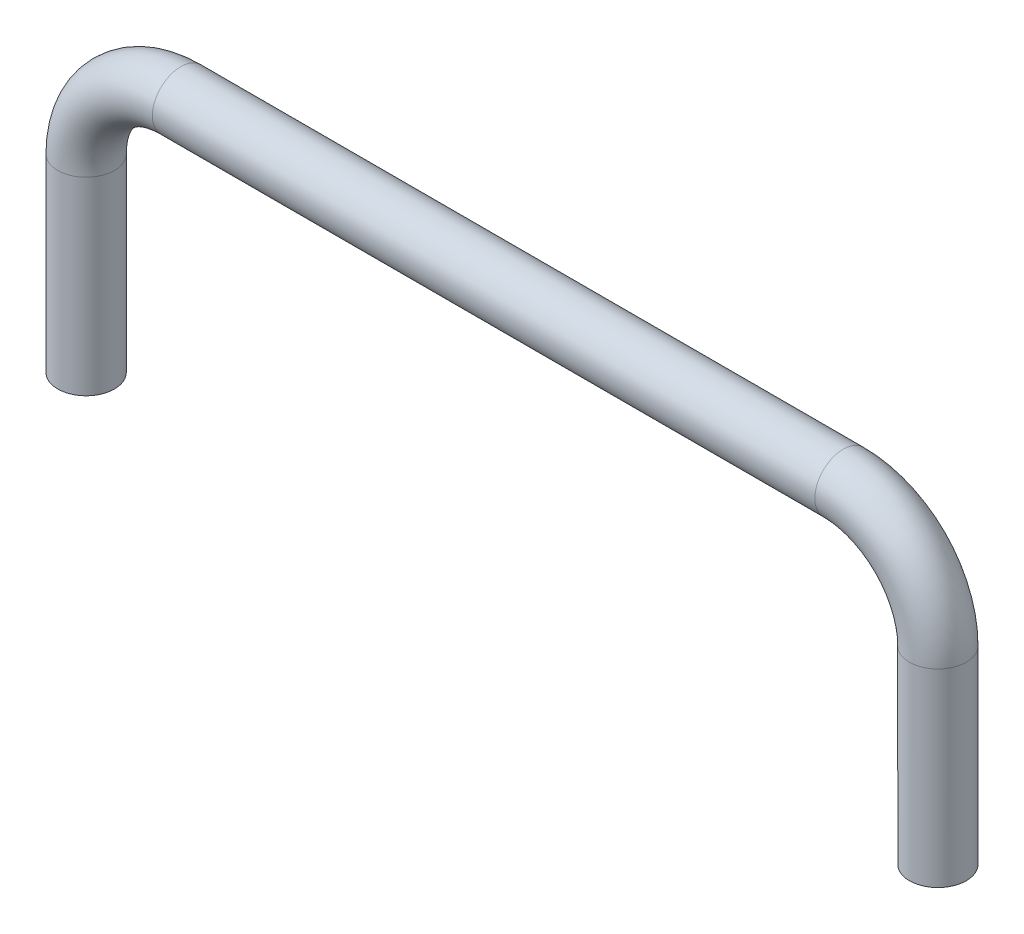
from build123d import *

# Parameters (mm, degrees)
SKETCH_2_R          = 3
SKETCH_3_R          = 1.6
CUT_EXTRUDE_1_DEPTH = 10


with BuildPart() as part:
    # 扫描1: sweep along a path in 草图1
    with BuildLine(Plane.XY) as sweep_1_path:
        Line((0, 0), (0, 20))
        ThreePointArc((0, 20), (2.928932188, 27.071067812), (10, 30))
        Line((10, 30), (80, 30))
        ThreePointArc((80, 30), (87.071067812, 27.071067812), (90, 20))
        Line((90, 20), (90, 0))
    # 草图2 → 扫描1 (sweep)
    with BuildSketch(Plane(origin=(0, 0, 0), x_dir=(1, 0, 0), z_dir=(0, 1, 0))):
        Circle(SKETCH_2_R)
    sweep(path=sweep_1_path.line)

    # 草图3 → 切除-拉伸1 (cut)
    with BuildSketch(Plane.XZ):
        with Locations(Location((0, 0, 0), (0, 0, 270))):
            Circle(SKETCH_3_R)
        with Locations(Location((90, 0, 0), (0, 0, 270))):
            Circle(SKETCH_3_R)
    extrude(amount=-CUT_EXTRUDE_1_DEPTH, mode=Mode.SUBTRACT)


solid = part.part
